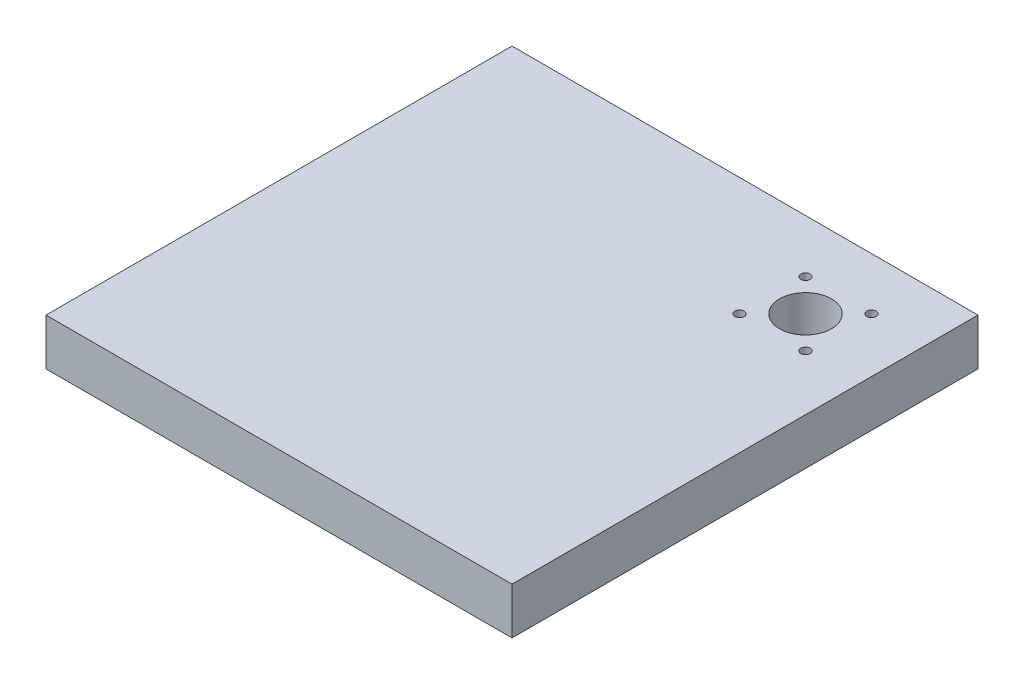
from build123d import *

# Parameters (mm, degrees)
SKETCH1_W               = 254
SKETCH1_H               = 254
BOSS_EXTRUDE1_DEPTH     = 25.4
F_10_CLEARANCE_HOLE1_D  = 5.1054
F_1_1_115_DOWEL_HOLE1_D = 28.321


with BuildPart() as part:
    # Sketch1 → Boss-Extrude1 (new body)
    with BuildSketch(Plane(origin=(0, 0, 0), x_dir=(1, 0, 0), z_dir=(0, 1, 0))):
        Rectangle(SKETCH1_W, SKETCH1_H)
    extrude(amount=BOSS_EXTRUDE1_DEPTH)

    # #10 Clearance Hole1 (through all)
    with Locations(Plane(origin=(0, 0, 0), x_dir=(-1, 0, 0), z_dir=(0, -1, 0))):
        with Locations((-61.414487758, 62.639487758), (-97.335512242, 98.560512242), (-61.875, 98.1), (-96.875, 63.1)):
            Hole(F_10_CLEARANCE_HOLE1_D / 2)

    # 1 (1.115) Dowel Hole1 (through all)
    with Locations(Plane(origin=(0, 0, 0), x_dir=(-1, 0, 0), z_dir=(0, -1, 0))):
        with Locations((-79.375, 80.6)):
            Hole(F_1_1_115_DOWEL_HOLE1_D / 2)


solid = part.part
